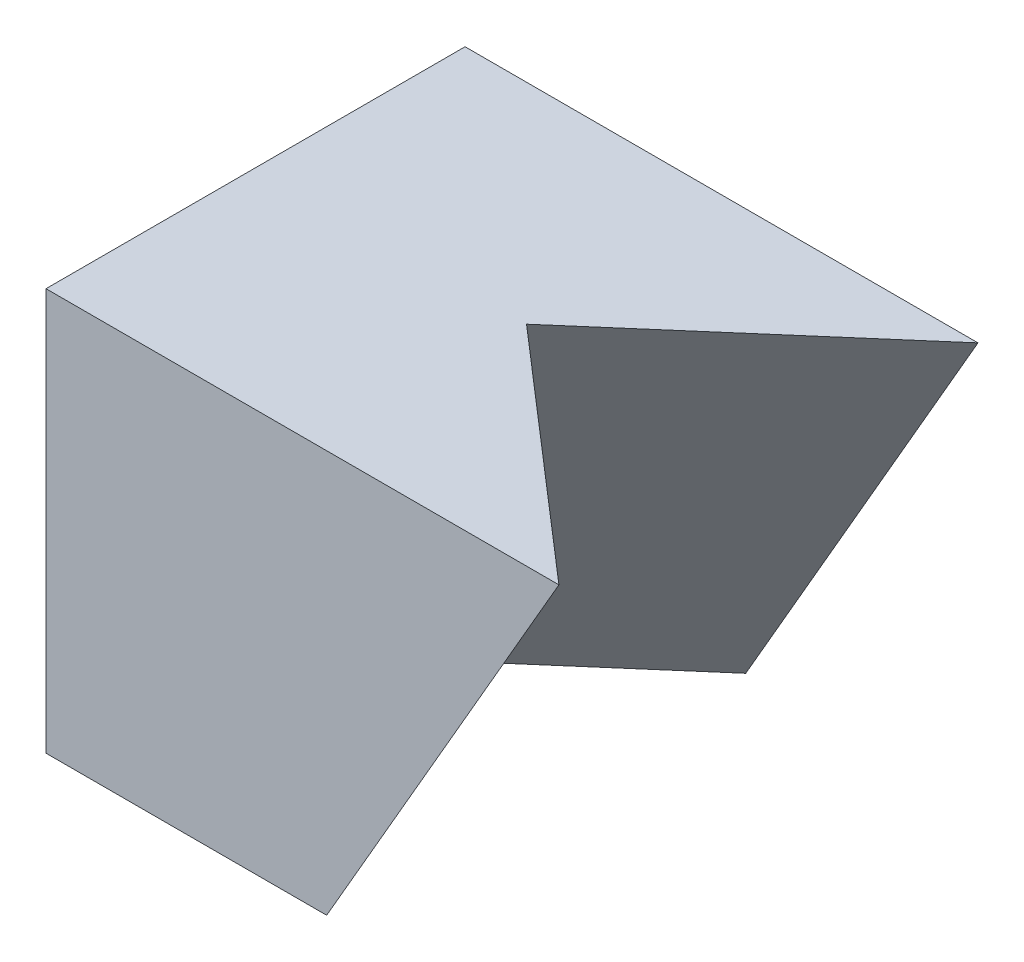
from build123d import *

# Parameters (mm, degrees)
SKETCH1_W           = 35
SKETCH1_H           = 25
BOSS_EXTRUDE1_DEPTH = 24
CUT_EXTRUDE1_DEPTH  = 41.397006939
SKETCH5_R           = 0.95
CUT_EXTRUDE2_DEPTH  = 7


with BuildPart() as part:
    # Sketch1 → Boss-Extrude1 (new body)
    with BuildSketch(Plane(origin=(0, 0, 0), x_dir=(1, 0, 0), z_dir=(0, 1, 0))):
        Rectangle(SKETCH1_W, SKETCH1_H)
    extrude(amount=BOSS_EXTRUDE1_DEPTH)

    # Sketch4 → Cut-Extrude1 (cut, through all)
    with BuildSketch(Plane(origin=(-4.375, -7.577722283, 0), x_dir=(-0.8660254037844417, 0.49999999999999495, 0), z_dir=(-0.49999999999999495, -0.8660254037844417, 0))):
        Polygon((-7.25, 20.405444566), (13.155444566, 0), (-7.25, -20.405444566), (-27.655444566, 0), align=None)
    extrude(amount=-CUT_EXTRUDE1_DEPTH, mode=Mode.SUBTRACT)

    # Sketch5 → Cut-Extrude2 (cut)
    with BuildSketch(Plane.ZY.offset(17.5)):
        with Locations((-10.5, 22)):
            Circle(SKETCH5_R)
        with Locations((10.5, 22)):
            Circle(SKETCH5_R)
        with Locations((10.5, 9.5)):
            Circle(SKETCH5_R)
        with Locations((-10.5, 9.5)):
            Circle(SKETCH5_R)
    extrude(amount=-CUT_EXTRUDE2_DEPTH, mode=Mode.SUBTRACT)


solid = part.part
